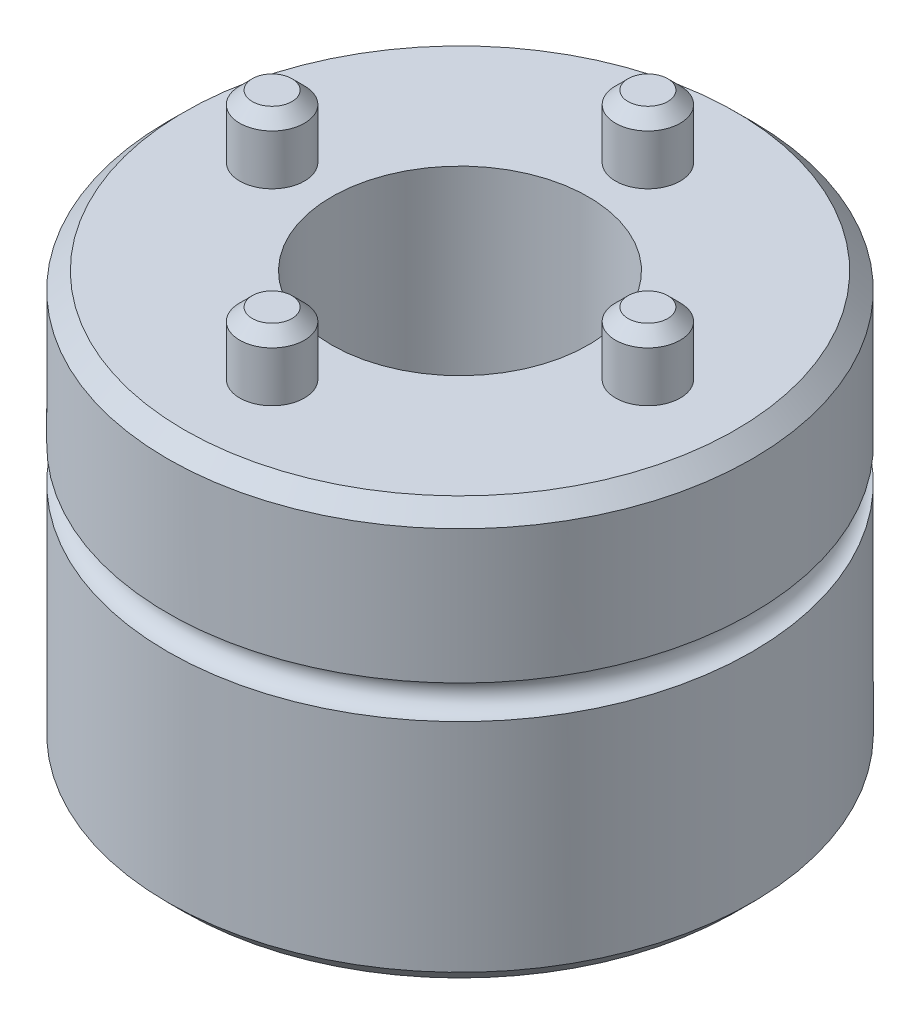
from build123d import *

# Parameters (mm, degrees)
SKETCH1_R                    = 7
SKETCH1_R_2                  = 0.975
BOSS_EXTRUDE1_DEPTH          = 5
SKETCH3_R                    = 3.075
CUT_EXTRUDE1_DEPTH           = 5
SKETCH4_R                    = 0.775
BOSS_EXTRUDE3_DEPTH          = 1.5
CHAMFER1_SIZE                = 0.3
CIRPATTERN1_COUNT            = 4
CHAMFER1_OF_CIRPATTERN1_SIZE = 0.3
SKETCH8_R                    = 0.4
CHAMFER2_SIZE                = 0.4


with BuildPart() as part:
    # Sketch1 → Boss-Extrude1 (new, symmetric)
    with BuildSketch(Plane(origin=(0, 0, 0), x_dir=(1, 0, 0), z_dir=(0, 1, 0))):
        with Locations(Location((0, 0, 0), (0, 0, 270))):
            Circle(SKETCH1_R)
        with Locations(Location((0, 0, 0), (0, 0, 270))):
            Circle(SKETCH1_R_2, mode=Mode.SUBTRACT)
    extrude(amount=BOSS_EXTRUDE1_DEPTH, both=True)

    # Sketch3 → Cut-Extrude1 (cut)
    with BuildSketch(Plane(origin=(0, 5, 0), x_dir=(1, 0, 0), z_dir=(0, 1, 0))):
        with Locations(Location((0, 0, 0), (0, 0, 270))):
            Circle(SKETCH3_R)
    extrude(amount=-CUT_EXTRUDE1_DEPTH, mode=Mode.SUBTRACT)

    # Sketch4 → Boss-Extrude3 (add)
    with BuildSketch(Plane.XZ.offset(-5)):
        with Locations(Location((4.5, 0, 0), (0, 0, 270))):
            Circle(SKETCH4_R)
    boss_extrude3 = extrude(amount=-BOSS_EXTRUDE3_DEPTH)

    # Chamfer1
    chamfer1_edges = [part.edges().sort_by_distance(p)[0] for p in [
        (4.5, 6.5, 0.775),
    ]]
    chamfer(chamfer1_edges, length=CHAMFER1_SIZE)

    # CirPattern1: Boss-Extrude3 ×4 about axis
    cirpattern1_axis = Axis((0, 0, 0), (0, 1, 0))
    for i in range(1, CIRPATTERN1_COUNT):
        add(boss_extrude3.rotate(cirpattern1_axis, i * 360 / CIRPATTERN1_COUNT))

    # Chamfer1 of CirPattern1
    chamfer1_of_cirpattern1_edges = [part.edges().sort_by_distance(p)[0] for p in [
        (0.775, 6.5, -4.5),
        (-4.5, 6.5, -0.775),
        (-0.775, 6.5, 4.5),
    ]]
    chamfer(chamfer1_of_cirpattern1_edges, length=CHAMFER1_OF_CIRPATTERN1_SIZE)

    # Sketch8 → Cut-Revolve1 (revolve, cut)
    with BuildSketch(Plane.XY, mode=Mode.PRIVATE) as cut_revolve1_sk:
        with Locations((7, 1)):
            Circle(SKETCH8_R)
    revolve(cut_revolve1_sk.sketch.rotate(Axis((0, 0, 0), (0, 1, 0)), 90), axis=Axis((0, 0, 0), (0, 1, 0)), mode=Mode.SUBTRACT)

    # Chamfer2
    chamfer2_edges = [part.edges().sort_by_distance(p)[0] for p in [
        (0, -5, -7),
        (0, 5, -7),
    ]]
    chamfer(chamfer2_edges, length=CHAMFER2_SIZE)


solid = part.part
